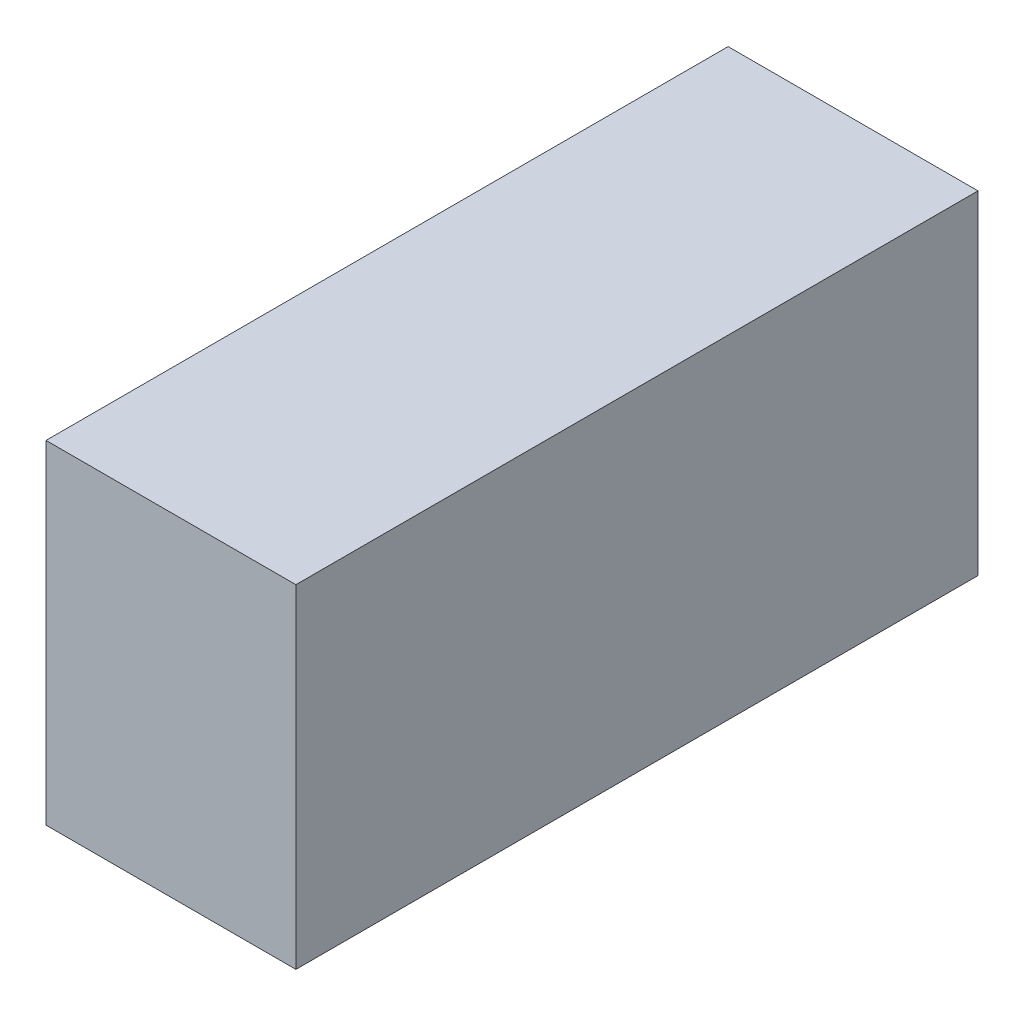
from build123d import *

# Parameters (mm, degrees)
SKETCH2_W           = 4.7625
SKETCH2_H           = 6.35
BOSS_EXTRUDE1_DEPTH = 13


with BuildPart() as part:
    # Sketch2 → Boss-Extrude1 (new body)
    with BuildSketch(Plane.XY):
        with Locations((-2.81875, -0.5)):
            Rectangle(SKETCH2_W, SKETCH2_H)
    extrude(amount=BOSS_EXTRUDE1_DEPTH)


solid = part.part
